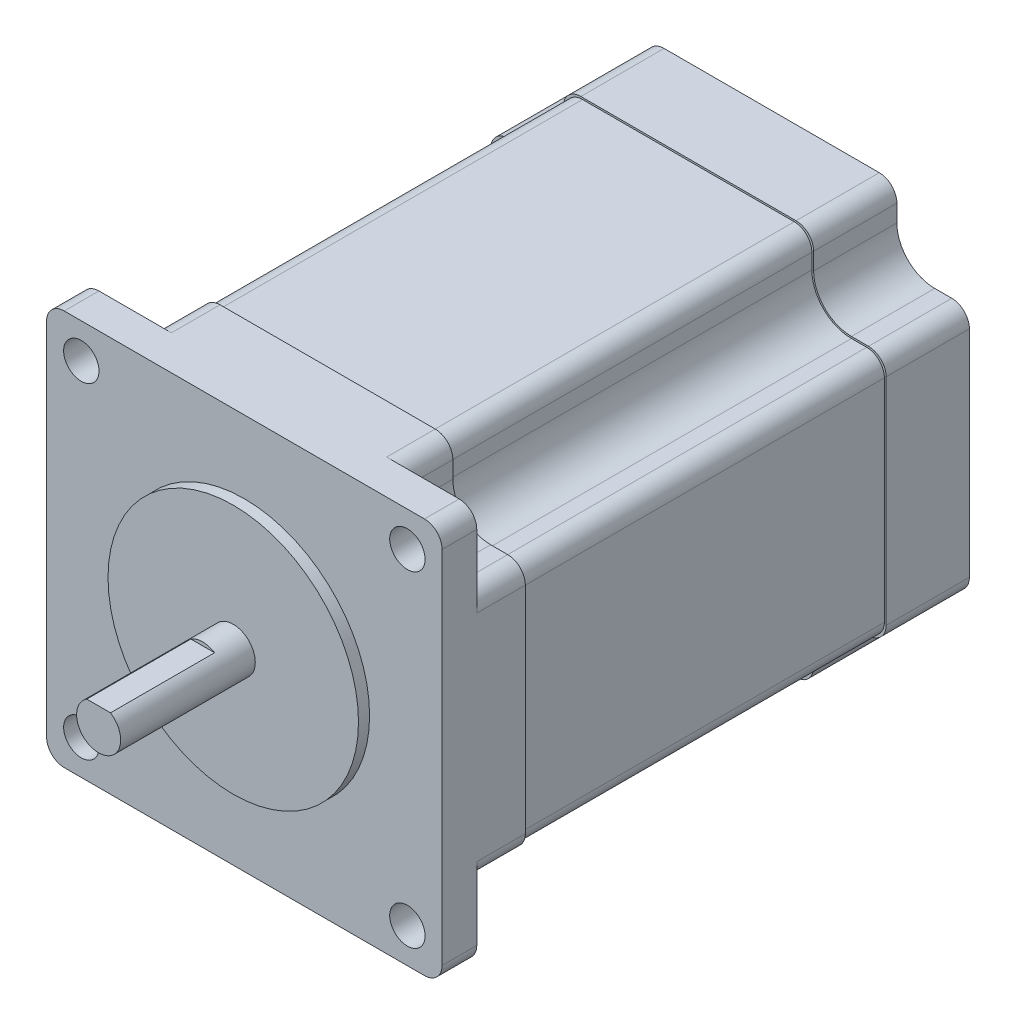
from build123d import *

# Parameters (mm, degrees)
SKETCH1_W           = 57
SKETCH1_H           = 57
SKETCH1_R           = 2.55
BOSS_EXTRUDE1_DEPTH = 5
BOSS_EXTRUDE2_DEPTH = 7
BOSS_EXTRUDE5_DEPTH = 52
BOSS_EXTRUDE6_DEPTH = 12
SKETCH7_R           = 18.05
BOSS_EXTRUDE7_DEPTH = 1.6
SKETCH8_R           = 3.175
BOSS_EXTRUDE8_DEPTH = 21
SKETCH9_W           = 15
SKETCH9_H           = 0.5
CUT_EXTRUDE1_DEPTH  = 3.5
FILLET1_R           = 2.54


with BuildPart() as part:
    # Sketch1 → Boss-Extrude1 (new body)
    with BuildSketch(Plane.XY):
        Rectangle(SKETCH1_W, SKETCH1_H)
        with Locations((-23.5, 23.5)):
            Circle(SKETCH1_R, mode=Mode.SUBTRACT)
        with Locations((23.5, 23.5)):
            Circle(SKETCH1_R, mode=Mode.SUBTRACT)
        with Locations((23.5, -23.5)):
            Circle(SKETCH1_R, mode=Mode.SUBTRACT)
        with Locations((-23.5, -23.5)):
            Circle(SKETCH1_R, mode=Mode.SUBTRACT)
    extrude(amount=-BOSS_EXTRUDE1_DEPTH)

    # Sketch2 → Boss-Extrude2 (add)
    with BuildSketch(Plane(origin=(0, 0, -5), x_dir=(-1, 0, 0), z_dir=(0, 0, -1))):
        with BuildLine():
            Line((-18.05, 23.5), (-18.05, 28.5))
            Line((-18.05, 28.5), (18.05, 28.5))
            Line((18.05, 28.5), (18.05, 23.5))
            ThreePointArc((18.05, 23.5), (19.646268043, 19.646268043), (23.5, 18.05))
            Line((23.5, 18.05), (28.5, 18.05))
            Line((28.5, 18.05), (28.5, -18.05))
            Line((28.5, -18.05), (23.5, -18.05))
            ThreePointArc((23.5, -18.05), (19.646268043, -19.646268043), (18.05, -23.5))
            Line((18.05, -23.5), (18.05, -28.5))
            Line((18.05, -28.5), (-18.05, -28.5))
            Line((-18.05, -28.5), (-18.05, -23.5))
            ThreePointArc((-18.05, -23.5), (-19.646268043, -19.646268043), (-23.5, -18.05))
            Line((-23.5, -18.05), (-28.5, -18.05))
            Line((-28.5, -18.05), (-28.5, 18.05))
            Line((-28.5, 18.05), (-23.5, 18.05))
            ThreePointArc((-23.5, 18.05), (-19.646268043, 19.646268043), (-18.05, 23.5))
        make_face()
    extrude(amount=BOSS_EXTRUDE2_DEPTH)

    # Sketch5 → Boss-Extrude5 (add)
    with BuildSketch(Plane(origin=(0, 0, -12), x_dir=(-1, 0, 0), z_dir=(0, 0, -1))):
        with BuildLine():
            Line((-23.5, 17.796), (-28.246, 17.796))
            Line((-28.246, 17.796), (-28.246, -17.796))
            Line((-28.246, -17.796), (-23.5, -17.796))
            ThreePointArc((-23.5, -17.796), (-19.46666292, -19.46666292), (-17.796, -23.5))
            Line((-17.796, -23.5), (-17.796, -28.246))
            Line((-17.796, -28.246), (17.796, -28.246))
            Line((17.796, -28.246), (17.796, -23.5))
            ThreePointArc((17.796, -23.5), (19.46666292, -19.46666292), (23.5, -17.796))
            Line((23.5, -17.796), (28.246, -17.796))
            Line((28.246, -17.796), (28.246, 17.796))
            Line((28.246, 17.796), (23.5, 17.796))
            ThreePointArc((23.5, 17.796), (19.46666292, 19.46666292), (17.796, 23.5))
            Line((17.796, 23.5), (17.796, 28.246))
            Line((17.796, 28.246), (-17.796, 28.246))
            Line((-17.796, 28.246), (-17.796, 23.5))
            ThreePointArc((-17.796, 23.5), (-19.46666292, 19.46666292), (-23.5, 17.796))
        make_face()
    extrude(amount=BOSS_EXTRUDE5_DEPTH)

    # Sketch6 → Boss-Extrude6 (add)
    with BuildSketch(Plane(origin=(0, 0, -64), x_dir=(-1, 0, 0), z_dir=(0, 0, -1))):
        with BuildLine():
            Line((-23.5, 18.05), (-28.5, 18.05))
            Line((-28.5, 18.05), (-28.5, -18.05))
            Line((-28.5, -18.05), (-23.5, -18.05))
            ThreePointArc((-23.5, -18.05), (-19.646268043, -19.646268043), (-18.05, -23.5))
            Line((-18.05, -23.5), (-18.05, -28.5))
            Line((-18.05, -28.5), (18.05, -28.5))
            Line((18.05, -28.5), (18.05, -23.5))
            ThreePointArc((18.05, -23.5), (19.646268043, -19.646268043), (23.5, -18.05))
            Line((23.5, -18.05), (28.5, -18.05))
            Line((28.5, -18.05), (28.5, 18.05))
            Line((28.5, 18.05), (23.5, 18.05))
            ThreePointArc((23.5, 18.05), (19.646268043, 19.646268043), (18.05, 23.5))
            Line((18.05, 23.5), (18.05, 28.5))
            Line((18.05, 28.5), (-18.05, 28.5))
            Line((-18.05, 28.5), (-18.05, 23.5))
            ThreePointArc((-18.05, 23.5), (-19.646268043, 19.646268043), (-23.5, 18.05))
        make_face()
    extrude(amount=BOSS_EXTRUDE6_DEPTH)

    # Sketch7 → Boss-Extrude7 (add)
    with BuildSketch(Plane.XY):
        with Locations(Location((0, 0, 0), (0, 0, 180))):
            Circle(SKETCH7_R)
    extrude(amount=BOSS_EXTRUDE7_DEPTH)

    # Sketch8 → Boss-Extrude8 (add)
    with BuildSketch(Plane.XY):
        with Locations(Location((0, 0, 0), (0, 0, 180))):
            Circle(SKETCH8_R)
    extrude(amount=BOSS_EXTRUDE8_DEPTH)

    # Sketch9 → Cut-Extrude1 (cut, symmetric)
    with BuildSketch(Plane(origin=(0, 0, 0), x_dir=(0, 0, -1), z_dir=(1, 0, 0))):
        with Locations((-13.5, 2.925)):
            Rectangle(SKETCH9_W, SKETCH9_H)
    extrude(amount=CUT_EXTRUDE1_DEPTH, both=True, mode=Mode.SUBTRACT)

    # Fillet1
    fillet1_edges = [part.edges().sort_by_distance(p)[0] for p in [
        (28.5, 18.05, -70),
        (28.5, -18.05, -70),
        (18.05, -28.5, -70),
        (-18.05, -28.5, -70),
        (-28.5, -18.05, -70),
        (-28.5, 18.05, -70),
        (-18.05, 28.5, -70),
        (18.05, 28.5, -70),
        (28.5, 18.05, -8.5),
        (28.5, -18.05, -8.5),
        (18.05, -28.5, -8.5),
        (-18.05, -28.5, -8.5),
        (-28.5, -18.05, -8.5),
        (-28.5, 18.05, -8.5),
        (-18.05, 28.5, -8.5),
        (18.05, 28.5, -8.5),
        (28.5, -28.5, -2.5),
        (-28.5, -28.5, -2.5),
        (-28.5, 28.5, -2.5),
        (28.5, 28.5, -2.5),
        (28.246, 17.796, -38),
        (28.246, -17.796, -38),
        (17.796, -28.246, -38),
        (-17.796, -28.246, -38),
        (-28.246, -17.796, -38),
        (-28.246, 17.796, -38),
        (-17.796, 28.246, -38),
        (17.796, 28.246, -38),
    ]]
    fillet(fillet1_edges, radius=FILLET1_R)


solid = part.part
